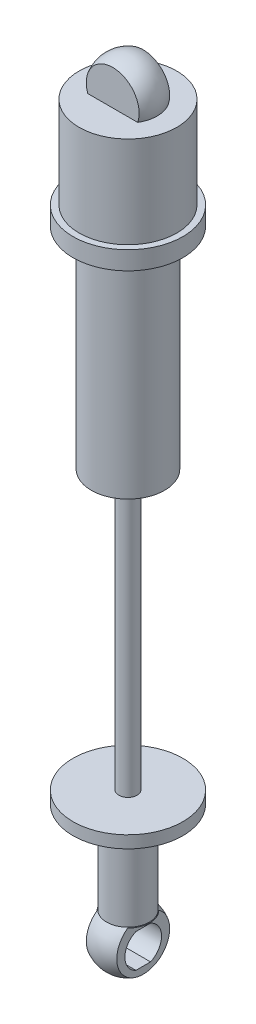
from build123d import *

# Parameters (mm, degrees)
SKETCH_2_OUTSIDE_W   = 46.494
SKETCH_2_OUTSIDE_H   = 46.494
SKETCH_2_OUTSIDE_W_2 = 10
SKETCH_2_OUTSIDE_H_2 = 5
CUT_EXTRUDE_1_DEPTH  = 10
SKETCH_3_OUTSIDE_W   = 46.494
SKETCH_3_OUTSIDE_H   = 46.494
SKETCH_3_OUTSIDE_W_2 = 5
SKETCH_3_OUTSIDE_H_2 = 20
CUT_EXTRUDE_2_DEPTH  = 8.5
CUT_EXTRUDE_3_DEPTH  = 131.817621137


with BuildPart() as part:
    # Эскиз1 → Повернуть2 (revolve)
    with BuildSketch(Plane.XY, mode=Mode.PRIVATE) as revolve_2_sk:
        with BuildLine():
            Line((-3.5, 8.570714214), (-3.5, 23.570714214))
            Line((-3.5, 23.570714214), (-9, 23.570714214))
            Line((-9, 23.570714214), (-9, 25.570714214))
            Line((-9, 25.570714214), (-1.5, 25.570714214))
            Line((-1.5, 25.570714214), (-1.5, 71.070714214))
            Line((-1.5, 71.070714214), (-6, 71.070714214))
            Line((-6, 71.070714214), (-6, 105.570714214))
            Line((-6, 105.570714214), (-9, 105.570714214))
            Line((-9, 105.570714214), (-9, 108.570714214))
            Line((-9, 108.570714214), (-8, 108.570714214))
            Line((-8, 108.570714214), (-8, 123.570714214))
            Line((-8, 123.570714214), (-4.791361199, 123.570714214))
            ThreePointArc((-4.791361199, 123.570714214), (-4.009141362, 127.987772671), (0, 130))
            Line((0, 130), (0, 125))
            Line((0, 125), (0, 0))
            ThreePointArc((0, 0), (-4.628907596, 3.109705191), (-3.5, 8.570714214))
        make_face()
    revolve(revolve_2_sk.sketch.rotate(Axis((0, 125, 0), (0, -1, 0)), 270), axis=Axis((0, 125, 0), (0, -1, 0)))

    # Эскиз2 outside → Вырез-Вытянуть1 (cut)
    with BuildSketch(Plane(origin=(0, 123.570714214, 0), x_dir=(1, 0, 0), z_dir=(0, 1, 0))):
        Rectangle(SKETCH_2_OUTSIDE_W, SKETCH_2_OUTSIDE_H)
        Rectangle(SKETCH_2_OUTSIDE_W_2, SKETCH_2_OUTSIDE_H_2, mode=Mode.SUBTRACT)
    extrude(amount=CUT_EXTRUDE_1_DEPTH, mode=Mode.SUBTRACT)

    # Эскиз3 outside → Вырез-Вытянуть2 (cut)
    with BuildSketch(Plane(origin=(0, 0, 0), x_dir=(1, 0, 0), z_dir=(0, 1, 0))):
        Rectangle(SKETCH_3_OUTSIDE_W, SKETCH_3_OUTSIDE_H)
        Rectangle(SKETCH_3_OUTSIDE_W_2, SKETCH_3_OUTSIDE_H_2, mode=Mode.SUBTRACT)
    extrude(amount=CUT_EXTRUDE_2_DEPTH, mode=Mode.SUBTRACT)

    # Эскиз4 → Вырез-Вытянуть3 (cut, through all)
    with BuildSketch(Plane(origin=(2.5, 0, 0), x_dir=(0, 0, -1), z_dir=(1, 0, 0))):
        with BuildLine():
            Line((-1.198957881, 7.334936491), (1.198957881, 7.334936491))
            ThreePointArc((1.198957881, 7.334936491), (3, 4.584936491), (1.198957881, 1.834936491))
            Line((1.198957881, 1.834936491), (-1.198957881, 1.834936491))
            ThreePointArc((-1.198957881, 1.834936491), (-3, 4.584936491), (-1.198957881, 7.334936491))
        make_face()
    extrude(amount=-CUT_EXTRUDE_3_DEPTH, mode=Mode.SUBTRACT)


solid = part.part
